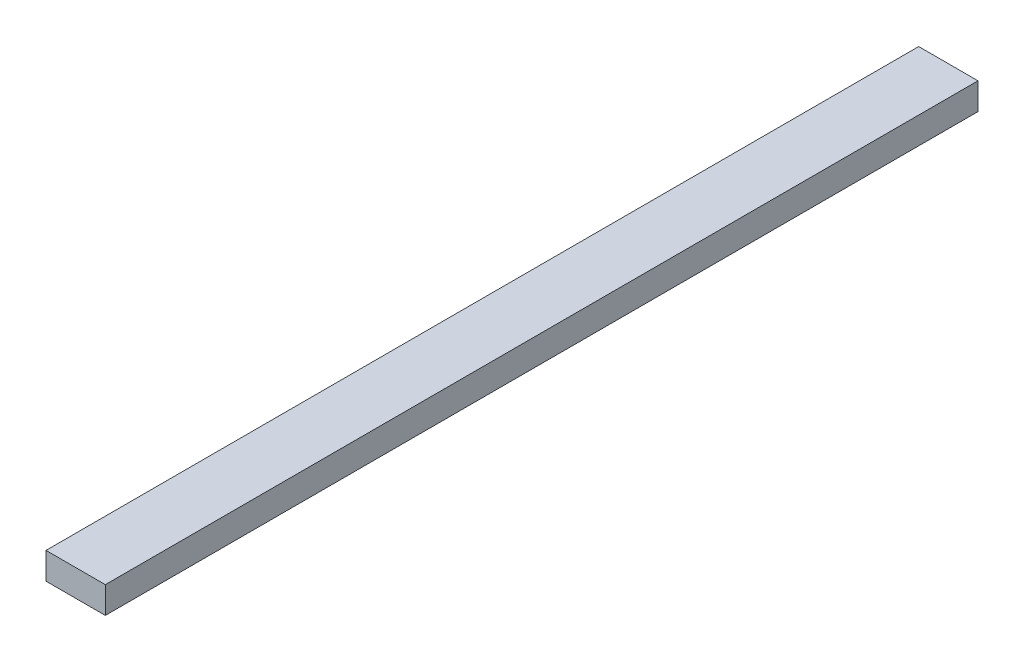
from build123d import *

# Parameters (mm, degrees)
SKETCH2_W           = 80
SKETCH2_H           = 36
BOSS_EXTRUDE1_DEPTH = 1177


with BuildPart() as part:
    # Sketch2 → Boss-Extrude1 (new body)
    with BuildSketch(Plane.XY):
        with Locations((-112.586206897, 37.603448276)):
            Rectangle(SKETCH2_W, SKETCH2_H)
    extrude(amount=BOSS_EXTRUDE1_DEPTH)


solid = part.part
